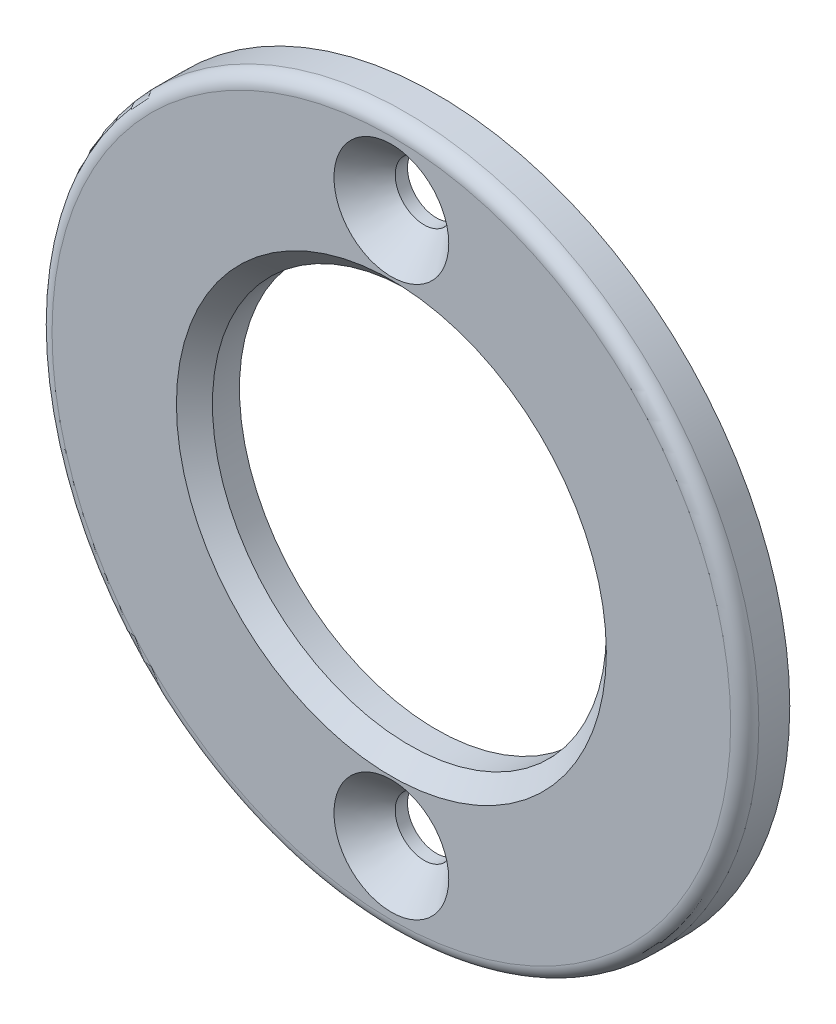
from build123d import *

# Parameters (mm, degrees)
SKETCH1_R                                     = 19.939
BOSS_EXTRUDE1_DEPTH                           = 2.54
F_7_8_0_875_DIAMETER_HOLE1_D                  = 22.225
CSK_FOR_4_FLAT_HEAD_SOCKET_CAP_SCREW1_A_COUNT = 2
CSK_FOR_4_FLAT_HEAD_SOCKET_CAP_SCREW1_A_PITCH = 31.0515
CHAMFER1_SIZE                                 = 1.016
FILLET1_R                                     = 0.79375


with BuildPart() as part:
    # Sketch1 → Boss-Extrude1 (new body)
    with BuildSketch(Plane.XY):
        Circle(SKETCH1_R)
    extrude(amount=BOSS_EXTRUDE1_DEPTH)

    # 7/8 (0.875) Diameter Hole1 (through all)
    with Locations(Plane.XY.offset(2.54)):
        with Locations((0, 0)):
            Hole(F_7_8_0_875_DIAMETER_HOLE1_D / 2)

    # Sketch24 → CSK for #4 Flat Head Socket Cap Screw1 (revolve, cut)
    with BuildSketch(Plane(origin=(0, 15.52575, 2.54), x_dir=(0, -1, 0), z_dir=(1, 0, 0))):
        Polygon((0, 0), (0, 2.54), (1.63195, 2.54), (1.63195, 1.848124365), (3.2385, 0), align=None)
    csk_for_4_flat_head_socket_cap_screw1 = revolve(axis=Axis((0, 15.52575, 8.89), (0, 0, -1)), mode=Mode.SUBTRACT)

    # CSK for #4 Flat Head Socket Cap Screw1 a: CSK for #4 Flat Head Socket Cap Screw1 ×2
    with Locations(*[(0, -i * CSK_FOR_4_FLAT_HEAD_SOCKET_CAP_SCREW1_A_PITCH, 0) for i in range(1, CSK_FOR_4_FLAT_HEAD_SOCKET_CAP_SCREW1_A_COUNT)]):
        add(csk_for_4_flat_head_socket_cap_screw1, mode=Mode.SUBTRACT)

    # Chamfer1
    chamfer1_edges = [part.edges().sort_by_distance(p)[0] for p in [
        (11.1125, 0, 2.54),
    ]]
    chamfer(chamfer1_edges, length=CHAMFER1_SIZE)

    # Fillet1
    fillet1_edges = [part.edges().sort_by_distance(p)[0] for p in [
        (-19.939, 0, 2.54),
    ]]
    fillet(fillet1_edges, radius=FILLET1_R)


solid = part.part
